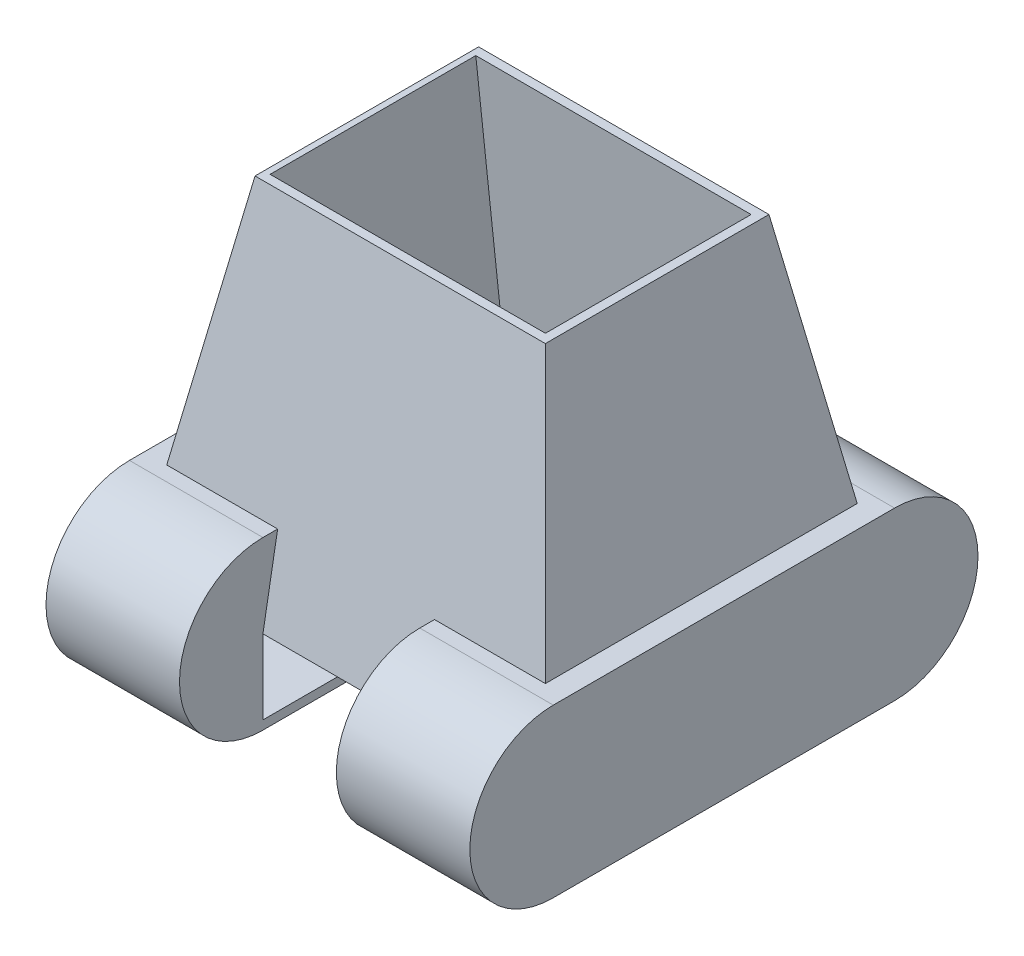
from build123d import *

# Parameters (mm, degrees)
SKETCH1_W                 = 52.2
SKETCH1_H                 = 40.2
BOSS_EXTRUDE1_DEPTH       = 60
BOSS_EXTRUDE1_DRAFT       = 10
CUT_EXTRUDE2_START        = 1.1
CUT_EXTRUDE2_DEPTH        = 49.5
SKETCH18_R                = 7.5
CUT_EXTRUDE3_DEPTH        = 101.215087122
BOSS_EXTRUDE15_DEPTH      = 12
BOSS_EXTRUDE15_DEPTH_BACK = 12
BOSS_EXTRUDE16_DEPTH      = 12
BOSS_EXTRUDE16_DEPTH_BACK = 12
BOSS_EXTRUDE16_START      = 52.2
SKETCH22_W                = 61.359237686
SKETCH22_H                = 13.4
CUT_EXTRUDE4_DEPTH        = 22.2
SKETCH23_W                = 61.359237686
SKETCH23_H                = 13.4
CUT_EXTRUDE5_DEPTH        = 22.2
CUT_EXTRUDE6_DEPTH        = 10.9
CUT_EXTRUDE7_DEPTH        = 10.4
SKETCH28_W                = 2.931149878
SKETCH28_H                = 13.818277995
BOSS_EXTRUDE17_DEPTH      = 1
SKETCH29_R                = 5.3
CUT_EXTRUDE8_DEPTH        = 4


with BuildPart() as part:
    # Sketch1 → Boss-Extrude1 (with draft: the straight prism first)
    with BuildSketch(Plane(origin=(0, 0, 0), x_dir=(1, 0, 0), z_dir=(0, 1, 0))):
        with Locations((26.1, -20.1)):
            Rectangle(SKETCH1_W, SKETCH1_H)
    extrude(amount=-BOSS_EXTRUDE1_DEPTH)
    # Boss-Extrude1: the draft: its side faces are tilted about the plane it starts from
    boss_extrude1_sides = [part.faces().sort_by_distance(p)[0] for p in [
        (0, -30, 20.1),
        (26.1, -30, 40.2),
        (52.2, -30, 20.1),
        (26.1, -30, 0),
    ]]
    draft(boss_extrude1_sides, Plane(origin=(0, 0, 0), x_dir=(1, 0, 0), z_dir=(0, 1, 0)), BOSS_EXTRUDE1_DRAFT)

    # Sketch5 → Cut-Extrude2 (cut)
    with BuildSketch(Plane(origin=(0, 0, 0), x_dir=(0, 0, -1), z_dir=(1, 0, 0)).offset(CUT_EXTRUDE2_START)):
        Polygon((4.083155602, -54.155466097), (-32.495141107, -58), (-41.830659729, 30.821526533), (-5.252363019, 34.666060436), align=None)
    extrude(amount=CUT_EXTRUDE2_DEPTH, mode=Mode.SUBTRACT)

    # Sketch18 → Cut-Extrude3 (cut, through all)
    with BuildSketch(Plane(origin=(0, -53.988220556, -5.674390635), x_dir=(1, 0, 0), z_dir=(0, 0.994521895368274, 0.1045284632676474))):
        with Locations(Location((25.85, -19.989890097, 0), (0, 0, 270))):
            Circle(SKETCH18_R)
    extrude(amount=-CUT_EXTRUDE3_DEPTH, mode=Mode.SUBTRACT)

    # Sketch19 → Boss-Extrude15 (add, two sides: drawn at the far end of the back side and taken through both)
    with BuildSketch(Plane(origin=(0, 0, 0), x_dir=(0, 0, -1), z_dir=(1, 0, 0)).offset(-BOSS_EXTRUDE15_DEPTH_BACK)):
        with BuildLine():
            Line((10.579618843, -75), (-50.779618843, -75))
            ThreePointArc((-50.779618843, -75), (-65.779618843, -60), (-50.779618843, -45))
            Line((-50.779618843, -45), (10.579618843, -45))
            ThreePointArc((10.579618843, -45), (25.579618843, -60), (10.579618843, -75))
        make_face()
    extrude(amount=BOSS_EXTRUDE15_DEPTH + BOSS_EXTRUDE15_DEPTH_BACK)

    # Sketch21 → Boss-Extrude16 (add, two sides: drawn at the far end of the back side and taken through both)
    with BuildSketch(Plane(origin=(0, 0, 0), x_dir=(0, 0, -1), z_dir=(1, 0, 0)).offset(BOSS_EXTRUDE16_START - BOSS_EXTRUDE16_DEPTH_BACK)):
        with BuildLine():
            Line((10.579618843, -75), (-50.779618843, -75))
            ThreePointArc((-50.779618843, -75), (-65.779618843, -60), (-50.779618843, -45))
            Line((-50.779618843, -45), (10.579618843, -45))
            ThreePointArc((10.579618843, -45), (25.579618843, -60), (10.579618843, -75))
        make_face()
    extrude(amount=BOSS_EXTRUDE16_DEPTH + BOSS_EXTRUDE16_DEPTH_BACK)

    # Sketch22 → Cut-Extrude4 (cut)
    with BuildSketch(Plane.ZY.offset(-40.2)):
        with Locations((20.1, -66.7)):
            Rectangle(SKETCH22_W, SKETCH22_H)
    extrude(amount=-CUT_EXTRUDE4_DEPTH, mode=Mode.SUBTRACT)

    # Sketch23 → Cut-Extrude5 (cut)
    with BuildSketch(Plane(origin=(12, 0, 0), x_dir=(0, 0, -1), z_dir=(1, 0, 0))):
        with Locations((-20.1, -66.7)):
            Rectangle(SKETCH23_W, SKETCH23_H)
    extrude(amount=-CUT_EXTRUDE5_DEPTH, mode=Mode.SUBTRACT)

    # Sketch25 → Cut-Extrude6 (cut)
    with BuildSketch(Plane(origin=(12, 0, 0), x_dir=(0, 0, -1), z_dir=(1, 0, 0))):
        Polygon((3.12087734, -45), (4.083155602, -54.155466097), (-32.495141107, -58), (-33.861496166, -45), align=None)
    extrude(amount=-CUT_EXTRUDE6_DEPTH, mode=Mode.SUBTRACT)

    # Sketch27 → Cut-Extrude7 (cut)
    with BuildSketch(Plane.ZY.offset(-40.2)):
        Polygon((-3.12087734, -45), (-4.083155602, -54.155466097), (32.495141107, -58), (33.861496166, -45), align=None)
    extrude(amount=-CUT_EXTRUDE7_DEPTH, mode=Mode.SUBTRACT)

    # Sketch28 → Boss-Extrude17 (add)
    # profile 1 of 5: a face of its own
    with BuildSketch(Plane(origin=(0, 0, 0), x_dir=(-1, 0, 0), z_dir=(0, 0.17364817766693072, -0.9848077530122081))):
        with BuildLine():
            add(Edge.make_bspline(
                [(-43.151648287, -30.888997763), (-43.157359033, -31.044116374), (-43.169605819, -31.376770722), (-43.255745364, -31.903189347), (-43.38350368, -32.492327796), (-43.532682581, -33.015525235), (-43.675391205, -33.455147584), (-43.821009509, -33.780751367), (-43.98087945, -34.10153206), (-44.174477884, -34.409363401), (-44.38489921, -34.710654111), (-44.624661706, -35.000306029), (-44.883784515, -35.283953944), (-45.167706966, -35.554130928), (-45.466807995, -35.804847099), (-45.785140635, -36.02255588), (-46.114386804, -36.210523723), (-46.460522356, -36.360429105), (-46.818950436, -36.481044973), (-47.192579955, -36.55897695), (-47.578258348, -36.616057484), (-47.840393767, -36.621133545), (-47.973651546, -36.623713986)],
                knots=[0, 0, 0, 0, 1.121454665, 2.404977508, 3.849516157, 5.479589953, 6.337360306, 7.188436048, 8.055936495, 8.926870334, 9.815087062, 10.711629643, 11.643569548, 12.591680928, 13.543718795, 14.462320347, 15.37678388, 16.280681946, 17.185817288, 18.106075594, 19.037214576, 20, 20, 20, 20], degree=3))
            add(Edge.make_bspline(
                [(-47.973651546, -36.623713986), (-48.176739295, -36.617771837), (-48.571539017, -36.606220385), (-49.143730482, -36.525246388), (-49.67688188, -36.384509035), (-50.169218014, -36.183234936), (-50.626828324, -35.931069472), (-51.041178007, -35.616377107), (-51.417351813, -35.247980524), (-51.748473596, -34.819748088), (-52.045014774, -34.339094488), (-52.298657535, -33.799463566), (-52.51404884, -33.204587629), (-52.689501915, -32.554382304), (-52.825750821, -31.849086529), (-52.922313737, -31.087485323), (-52.981565378, -30.269471481), (-52.988407564, -29.704865461), (-52.991937162, -29.413608706)],
                knots=[0, 0, 0, 0, 0.976313442, 1.897939566, 2.771627724, 3.62059927, 4.449120933, 5.276447373, 6.11432184, 6.973287784, 7.872496107, 8.824620814, 9.834698886, 10.910699926, 12.059222034, 13.285693438, 14.599802172, 16, 16, 16, 16], degree=3))
            add(Edge.make_bspline(
                [(-52.991937162, -29.413608706), (-52.988781071, -29.137583615), (-52.98265983, -28.602232894), (-52.917981704, -27.823610435), (-52.820100024, -27.094178927), (-52.676351481, -26.415172292), (-52.49271306, -25.786292839), (-52.272771701, -25.205360811), (-52.006778621, -24.674425443), (-51.698518487, -24.196105251), (-51.356150939, -23.767348746), (-50.973214014, -23.398708865), (-50.557866236, -23.084039779), (-50.107182423, -22.82733736), (-49.620668638, -22.629793012), (-49.100944599, -22.490357651), (-48.54688873, -22.403046911), (-48.165904731, -22.392244297), (-47.970380173, -22.386700294)],
                knots=[0, 0, 0, 0, 1.356189644, 2.630330089, 3.836862393, 4.970943455, 6.037585261, 7.053706142, 8.019532804, 8.950074571, 9.845592736, 10.709693686, 11.555335021, 12.400160919, 13.251016042, 14.128522887, 15.039540409, 16, 16, 16, 16], degree=3))
            add(Edge.make_bspline(
                [(-47.970380173, -22.386700294), (-47.829572061, -22.388696554), (-47.553822115, -22.392605906), (-47.151993107, -22.43822799), (-46.769456738, -22.500739508), (-46.409754471, -22.596656631), (-46.070244009, -22.716358533), (-45.754546951, -22.868758624), (-45.460346432, -23.045470754), (-45.183792961, -23.246136504), (-44.934226634, -23.479249888), (-44.702126642, -23.736776445), (-44.492914768, -24.02175461), (-44.306820374, -24.334953736), (-44.138371681, -24.673118382), (-43.995797987, -25.040352961), (-43.87440613, -25.434229752), (-43.811800149, -25.707780521), (-43.779751833, -25.847812538)],
                knots=[0, 0, 0, 0, 1.129057018, 2.211075827, 3.240836777, 4.23601623, 5.193451972, 6.124711576, 7.042894994, 7.943999526, 8.860263889, 9.777112737, 10.72195618, 11.691149788, 12.696619263, 13.74931233, 14.847861647, 16, 16, 16, 16], degree=3))
            Line((-43.779751833, -25.847812538), (-46.71090171, -26.992792959))
            add(Edge.make_bspline(
                [(-46.71090171, -26.992792959), (-46.720131502, -26.845102862), (-46.737508892, -26.567039324), (-46.820068598, -26.18100036), (-46.937395802, -25.84934441), (-47.106535522, -25.577369136), (-47.32090122, -25.363712811), (-47.58118404, -25.213411339), (-47.883840256, -25.122989812), (-48.099486698, -25.113469776), (-48.212461748, -25.108482323)],
                knots=[0, 0, 0, 0, 1.301746639, 2.450863545, 3.465966973, 4.385312678, 5.247865884, 6.10446279, 7.006946697, 8, 8, 8, 8], degree=3))
            add(Edge.make_bspline(
                [(-48.212461748, -25.108482323), (-48.312411445, -25.112586623), (-48.505110715, -25.120499558), (-48.778518827, -25.208467576), (-49.024598504, -25.342097633), (-49.235964554, -25.533899319), (-49.413735256, -25.76999333), (-49.557742813, -26.049093053), (-49.668667563, -26.369465359), (-49.729641709, -26.668061971), (-49.760980861, -26.938126262), (-49.789444074, -27.177657135), (-49.806649451, -27.451764564), (-49.823452567, -27.759262049), (-49.83589649, -28.100635436), (-49.846793224, -28.47574776), (-49.847778157, -28.884743808), (-49.85017495, -29.168258367), (-49.851419436, -29.315467527)],
                knots=[0, 0, 0, 0, 0.949082492, 1.829795474, 2.708729545, 3.599132703, 4.525888839, 5.511076447, 6.578964043, 7.746513465, 8.406302209, 9.169269644, 10.044203364, 11.022188287, 12.103485584, 13.298673948, 14.597391474, 16, 16, 16, 16], degree=3))
            add(Edge.make_bspline(
                [(-49.851419436, -29.315467527), (-49.850630796, -29.48885353), (-49.849117942, -29.821461111), (-49.84216003, -30.299084703), (-49.834019519, -30.73320072), (-49.816676319, -31.1257484), (-49.797513982, -31.475828169), (-49.776274422, -31.784771816), (-49.746313443, -32.049747247), (-49.705629546, -32.339596527), (-49.63356401, -32.652653455), (-49.510463536, -32.984230551), (-49.349417238, -33.267333469), (-49.151592606, -33.502109593), (-48.913595837, -33.681688789), (-48.644719398, -33.810970134), (-48.342054501, -33.887995402), (-48.130050609, -33.897154018), (-48.019450763, -33.901931956)],
                knots=[0, 0, 0, 0, 1.497791519, 2.873223929, 4.126387464, 5.248342962, 6.267259437, 7.155180523, 7.922886796, 8.570328392, 9.683071756, 10.690779459, 11.61498503, 12.483455621, 13.323728473, 14.170575714, 15.045611648, 16, 16, 16, 16], degree=3))
            add(Edge.make_bspline(
                [(-48.019450763, -33.901931956), (-47.890867348, -33.895205746), (-47.644028882, -33.882293602), (-47.297878416, -33.760124387), (-47.003705939, -33.55487124), (-46.756504242, -33.272959097), (-46.569397842, -32.907421109), (-46.423052119, -32.471148194), (-46.326911535, -31.955943224), (-46.304232533, -31.586227546), (-46.292166013, -31.389517775)],
                knots=[0, 0, 0, 0, 0.90044339, 1.728559353, 2.537665259, 3.394719718, 4.333251143, 5.400945295, 6.617155057, 8, 8, 8, 8], degree=3))
            Line((-46.292166013, -31.389517775), (-47.967108801, -31.389517775))
            Line((-47.967108801, -31.389517775), (-47.967108801, -28.667735746))
            Line((-47.967108801, -28.667735746), (-43.151648287, -28.667735746))
            Line((-43.151648287, -28.667735746), (-43.151648287, -30.888997763))
        make_face()
    # profile 2 of 5: a face of its own
    with BuildSketch(Plane(origin=(0, 0, 0), x_dir=(-1, 0, 0), z_dir=(0, 0.17364817766693072, -0.9848077530122081))):
        with BuildLine():
            add(Edge.make_bspline(
                [(-32.055152322, -32.472342116), (-32.059393479, -32.629480079), (-32.067664302, -32.935920088), (-32.118291282, -33.383342398), (-32.212517857, -33.80389327), (-32.333056921, -34.201768791), (-32.500344719, -34.57100968), (-32.698262788, -34.916128231), (-32.937954056, -35.232392026), (-33.207705105, -35.524283018), (-33.51385231, -35.781714709), (-33.845516472, -36.010286209), (-34.207415079, -36.19961802), (-34.597882453, -36.354615886), (-35.015830488, -36.473511972), (-35.460789374, -36.562853382), (-35.933719202, -36.615618233), (-36.258730724, -36.620966368), (-36.425706157, -36.623713986)],
                knots=[0, 0, 0, 0, 1.103720982, 2.152403284, 3.155816909, 4.12706611, 5.066360663, 5.996305647, 6.915275761, 7.847236615, 8.781711192, 9.718442352, 10.67075831, 11.643455606, 12.663821698, 13.71813717, 14.827687612, 16, 16, 16, 16], degree=3))
            add(Edge.make_bspline(
                [(-36.425706157, -36.623713986), (-36.598183683, -36.621385189), (-36.934287393, -36.616847108), (-37.421806217, -36.558283676), (-37.880005941, -36.472499325), (-38.306413476, -36.346548322), (-38.705827584, -36.192380336), (-39.070013996, -35.992634171), (-39.407017157, -35.76449253), (-39.708717648, -35.497073286), (-39.979178564, -35.198608179), (-40.211490978, -34.865901657), (-40.409990578, -34.503121659), (-40.568227992, -34.107998954), (-40.698164591, -33.685116858), (-40.782945177, -33.229591882), (-40.841804377, -32.745411227), (-40.846296435, -32.411468571), (-40.848601955, -32.24007466)],
                knots=[0, 0, 0, 0, 1.165544848, 2.27127532, 3.31530234, 4.313925356, 5.273713403, 6.204049178, 7.116179785, 8.019957837, 8.923134174, 9.833415281, 10.757271478, 11.712972645, 12.706629393, 13.743419474, 14.841824615, 16, 16, 16, 16], degree=3))
            Line((-40.848601955, -32.24007466), (-40.848601955, -22.596068142))
            Line((-40.848601955, -22.596068142), (-37.917452077, -22.596068142))
            Line((-37.917452077, -22.596068142), (-37.917452077, -31.69375543))
            add(Edge.make_bspline(
                [(-37.917452077, -31.69375543), (-37.912469357, -31.845615049), (-37.903085333, -32.131614295), (-37.832947741, -32.535067864), (-37.709395974, -32.883586709), (-37.536257425, -33.17764793), (-37.313739337, -33.408420291), (-37.049089355, -33.574549603), (-36.744646353, -33.675704671), (-36.527907344, -33.686819651), (-36.415892039, -33.692564108)],
                knots=[0, 0, 0, 0, 1.290356039, 2.43014474, 3.465030636, 4.417091307, 5.308439775, 6.162134463, 7.050152219, 8, 8, 8, 8], degree=3))
            add(Edge.make_bspline(
                [(-36.415892039, -33.692564108), (-36.310585756, -33.686108908), (-36.106602413, -33.673604874), (-35.816695508, -33.581489029), (-35.567392346, -33.416676405), (-35.355918496, -33.194197517), (-35.190826526, -32.915824439), (-35.069247199, -32.593925317), (-34.996883048, -32.22798837), (-34.989946713, -31.969985316), (-34.9863022, -31.834424453)],
                knots=[0, 0, 0, 0, 0.957670107, 1.855053117, 2.730220231, 3.649550038, 4.624589756, 5.654668157, 6.767707578, 8, 8, 8, 8], degree=3))
            Line((-34.9863022, -31.834424453), (-34.9863022, -22.596068142))
            Line((-34.9863022, -22.596068142), (-32.055152322, -22.596068142))
            Line((-32.055152322, -22.596068142), (-32.055152322, -32.472342116))
        make_face()
    # profile 3 of 5: a face of its own
    with BuildSketch(Plane(origin=(0, 0, 0), x_dir=(-1, 0, 0), z_dir=(0, 0.17364817766693072, -0.9848077530122081))):
        with Locations((-27.867795354, -29.50520714)):
            Rectangle(SKETCH28_W, SKETCH28_H)
    # profile 4 of 5: a face of its own
    with BuildSketch(Plane(origin=(0, 0, 0), x_dir=(-1, 0, 0), z_dir=(0, 0.17364817766693072, -0.9848077530122081))):
        Polygon((-10.699631784, -36.414346137), (-13.647138525, -36.414346137), (-14.425725212, -25.108482323), (-14.468253056, -25.108482323), (-16.431076635, -36.414346137), (-18.577097081, -36.414346137), (-20.520292424, -25.039783498), (-20.566091641, -25.039783498), (-21.36103519, -36.414346137), (-24.308541931, -36.414346137), (-22.842966992, -22.596068142), (-18.98601866, -22.596068142), (-17.56951431, -31.700298175), (-17.526986466, -31.700298175), (-15.969813094, -22.596068142), (-12.165206723, -22.596068142), align=None)
    # profile 5 of 5: a face of its own
    with BuildSketch(Plane(origin=(0, 0, 0), x_dir=(-1, 0, 0), z_dir=(0, 0.17364817766693072, -0.9848077530122081))):
        with BuildLine():
            add(Edge.make_bspline(
                [(-9.234056846, -29.446322432), (-9.232307595, -29.214022612), (-9.228930763, -28.765580588), (-9.199430862, -28.11743092), (-9.151084745, -27.517203611), (-9.083964695, -26.96460862), (-8.995285772, -26.460432655), (-8.893059947, -26.002608376), (-8.7667189, -25.593142132), (-8.571695748, -25.118632646), (-8.285019418, -24.592597227), (-7.898374611, -24.02329012), (-7.451467677, -23.534447835), (-7.036989732, -23.186943536), (-6.676601442, -22.955327159), (-6.391932061, -22.799043504), (-6.086101014, -22.673053876), (-5.765568986, -22.568452525), (-5.428817357, -22.486197014), (-5.074688974, -22.42678225), (-4.702666026, -22.395824509), (-4.449177982, -22.389773191), (-4.320455153, -22.386700294)],
                knots=[0, 0, 0, 0, 1.426317747, 2.753427955, 3.982843646, 5.123113348, 6.16997341, 7.125015381, 8.001763858, 8.797534365, 10.271371398, 11.67178984, 13.013080126, 14.325600942, 14.979345983, 15.64143842, 16.316672086, 17.006942697, 17.710114875, 18.443221219, 19.20945791, 20, 20, 20, 20], degree=3))
            add(Edge.make_bspline(
                [(-4.320455153, -22.386700294), (-4.112934069, -22.390820855), (-3.716825648, -22.398686026), (-3.154155456, -22.482096125), (-2.651534181, -22.611087789), (-2.207350369, -22.807696005), (-1.807199259, -23.057168978), (-1.42349972, -23.346949875), (-1.058130774, -23.689353146), (-0.707597212, -24.077300237), (-0.386692952, -24.514320686), (-0.108736535, -25.002913355), (0.114171822, -25.54402387), (0.266271034, -26.028631275), (0.365007671, -26.447083577), (0.42967734, -26.789937341), (0.484964213, -27.157684827), (0.531552799, -27.54923637), (0.561501903, -27.966351018), (0.590191583, -28.407853653), (0.600702109, -28.874879281), (0.604359779, -29.194428002), (0.606232029, -29.357995371)],
                knots=[0, 0, 0, 0, 1.283642861, 2.450169095, 3.512844041, 4.486066973, 5.443454109, 6.426273938, 7.457947732, 8.538164138, 9.658751154, 10.80744755, 12.008441606, 13.274446484, 13.94735415, 14.66885041, 15.43351341, 16.249011423, 17.108919167, 18.021772403, 18.987404859, 20, 20, 20, 20], degree=3))
            add(Edge.make_bspline(
                [(0.606232029, -29.357995371), (0.601512063, -29.688486509), (0.592437085, -30.323914741), (0.532864397, -31.237325117), (0.425283656, -32.07088533), (0.279259651, -32.825744059), (0.082177259, -33.499539887), (-0.150234543, -34.0975792), (-0.430317454, -34.61630777), (-0.759238939, -35.054120125), (-1.12292485, -35.422466365), (-1.504451815, -35.747074154), (-1.917856059, -36.014474316), (-2.351565853, -36.242368695), (-2.815216925, -36.408524352), (-3.300490494, -36.536869463), (-3.812428364, -36.607290608), (-4.162143977, -36.618175583), (-4.340083389, -36.623713986)],
                knots=[0, 0, 0, 0, 1.58703677, 3.051361599, 4.392572166, 5.62078322, 6.73926763, 7.75928079, 8.696645576, 9.560642986, 10.379005603, 11.178179351, 11.960991477, 12.738514211, 13.525448635, 14.32049457, 15.14544791, 16, 16, 16, 16], degree=3))
            add(Edge.make_bspline(
                [(-4.340083389, -36.623713986), (-4.521345347, -36.618561386), (-4.876750015, -36.608458562), (-5.395961366, -36.532927385), (-5.886931721, -36.404114856), (-6.351331713, -36.228153052), (-6.786571709, -35.997444179), (-7.191049958, -35.712732381), (-7.568442483, -35.380589293), (-7.920481599, -34.998524929), (-8.233810648, -34.550658852), (-8.506823158, -34.032713211), (-8.728058278, -33.439705341), (-8.914075658, -32.778688085), (-9.060051202, -32.047025579), (-9.162219963, -31.243628455), (-9.2246557, -30.368755781), (-9.23084389, -29.761575174), (-9.234056846, -29.446322432)],
                knots=[0, 0, 0, 0, 0.881591902, 1.728558392, 2.54557598, 3.346506061, 4.139083602, 4.935221238, 5.747125507, 6.580679793, 7.456346844, 8.398394405, 9.420979483, 10.529255357, 11.736034278, 13.046709329, 14.46662925, 16, 16, 16, 16], degree=3))
        make_face()
        with BuildLine():
            Line((-6.09353912, -28.63502202), (-6.09353912, -29.488850277))
            add(Edge.make_bspline(
                [(-6.09353912, -29.488850277), (-6.092757353, -29.656784129), (-6.091264833, -29.977397478), (-6.084293563, -30.436484351), (-6.076189154, -30.849886322), (-6.059134387, -31.21846856), (-6.039488609, -31.542341776), (-6.019072135, -31.82198764), (-5.988639526, -32.056369306), (-5.948826376, -32.304674739), (-5.869458637, -32.570243786), (-5.744154773, -32.856853002), (-5.570799296, -33.105544979), (-5.360927277, -33.315243052), (-5.119871852, -33.484608537), (-4.853567553, -33.605196817), (-4.564557955, -33.681590822), (-4.364566209, -33.688833915), (-4.261570446, -33.692564108)],
                knots=[0, 0, 0, 0, 1.553246606, 2.965403282, 4.246657748, 5.377392915, 6.377719641, 7.247967348, 7.969789696, 8.563397331, 9.57197776, 10.524378929, 11.444843268, 12.357706065, 13.255852458, 14.153998852, 15.049309284, 16, 16, 16, 16], degree=3))
            add(Edge.make_bspline(
                [(-4.261570446, -33.692564108), (-4.175908523, -33.68868204), (-4.005801497, -33.680973048), (-3.75993107, -33.602375686), (-3.523254557, -33.488410791), (-3.304344969, -33.321335911), (-3.1001949, -33.111554076), (-2.936156548, -32.84379193), (-2.79675683, -32.533561767), (-2.714783523, -32.236602084), (-2.66500241, -31.96276128), (-2.629111989, -31.71623414), (-2.600887646, -31.43124088), (-2.574426546, -31.110674177), (-2.555337008, -30.751770275), (-2.542464389, -30.35694273), (-2.53691326, -29.925048172), (-2.535184574, -29.625158111), (-2.534285697, -29.469222041)],
                knots=[0, 0, 0, 0, 0.807986165, 1.604494953, 2.421195107, 3.283726602, 4.195921205, 5.174763717, 6.236998149, 7.406184602, 8.078000645, 8.870288513, 9.762424652, 10.787170075, 11.913461847, 13.162541075, 14.524585327, 16, 16, 16, 16], degree=3))
            add(Edge.make_bspline(
                [(-2.534285697, -29.469222041), (-2.535089719, -29.328550026), (-2.536635518, -29.058096377), (-2.543452668, -28.667696743), (-2.552255142, -28.308845145), (-2.567555987, -27.981512814), (-2.592812636, -27.686295616), (-2.612977628, -27.421905265), (-2.642284827, -27.188241817), (-2.689017365, -26.923939997), (-2.763008428, -26.627913809), (-2.892100651, -26.306881485), (-3.054262782, -26.01836637), (-3.258330231, -25.773040697), (-3.490324689, -25.569654118), (-3.752948507, -25.423046651), (-4.042234555, -25.334217247), (-4.243492875, -25.323395627), (-4.346626134, -25.317850172)],
                knots=[0, 0, 0, 0, 1.334775808, 2.566217512, 3.704787436, 4.740758819, 5.674782154, 6.515995778, 7.256496276, 7.908015394, 9.062412841, 10.144134807, 11.182377154, 12.189210582, 13.157727458, 14.093354071, 15.022954135, 16, 16, 16, 16], degree=3))
            add(Edge.make_bspline(
                [(-4.346626134, -25.317850172), (-4.420898848, -25.320591512), (-4.565977895, -25.325946252), (-4.775574334, -25.360814501), (-4.969322855, -25.42437655), (-5.146014756, -25.512141774), (-5.306638313, -25.626335637), (-5.450477147, -25.764443549), (-5.579683592, -25.92693716), (-5.691283546, -26.1153642), (-5.784810643, -26.331844984), (-5.87152791, -26.573614885), (-5.936746431, -26.847381251), (-5.997920927, -27.147989415), (-6.037020437, -27.479664081), (-6.07068365, -27.838414664), (-6.090099562, -28.226981825), (-6.092362379, -28.495423418), (-6.09353912, -28.63502202)],
                knots=[0, 0, 0, 0, 0.844519725, 1.649624882, 2.406307828, 3.154821218, 3.884092072, 4.638231539, 5.414665641, 6.237521497, 7.119957868, 8.092389262, 9.153847213, 10.31608725, 11.578612828, 12.948014088, 14.412865306, 16, 16, 16, 16], degree=3))
        make_face(mode=Mode.SUBTRACT)
    extrude(amount=BOSS_EXTRUDE17_DEPTH)

    # Sketch29 → Cut-Extrude8 (cut)
    with BuildSketch(Plane(origin=(0, -53.988220556, -5.674390635), x_dir=(1, 0, 0), z_dir=(0, 0.994521895368274, 0.10452846326764743))):
        with Locations(Location((9.1, -9.6, 0), (0, 0, 270))):
            Circle(SKETCH29_R)
    extrude(amount=-CUT_EXTRUDE8_DEPTH, mode=Mode.SUBTRACT)


solid = part.part
